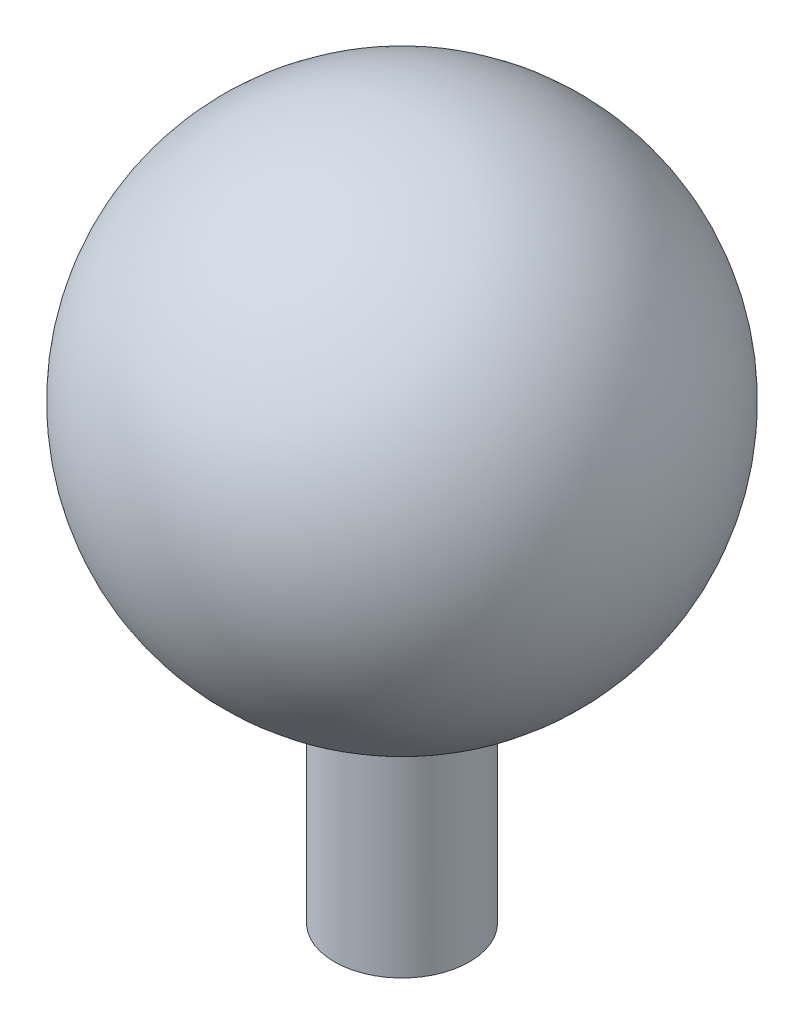
from build123d import *

# Parameters (mm, degrees)
SKETCH8_W = 5.376614224
SKETCH8_H = 35.934134015


with BuildPart() as part:
    # Sketch1 → Revolve1 (revolve)
    with BuildSketch(Plane.XY):
        with BuildLine():
            Line((0, 20), (0, -20))
            ThreePointArc((0, -20), (20, 0), (0, 20))
        make_face()
    revolve(axis=Axis((0, 20, 0), (0, -1, 0)))

    # Sketch8 → Revolve2 (revolve)
    with BuildSketch(Plane.XY):
        with Locations((2.688307112, -17.967067008)):
            Rectangle(SKETCH8_W, SKETCH8_H)
    revolve(axis=Axis((0, 0, 0), (0, -1, 0)))


solid = part.part
